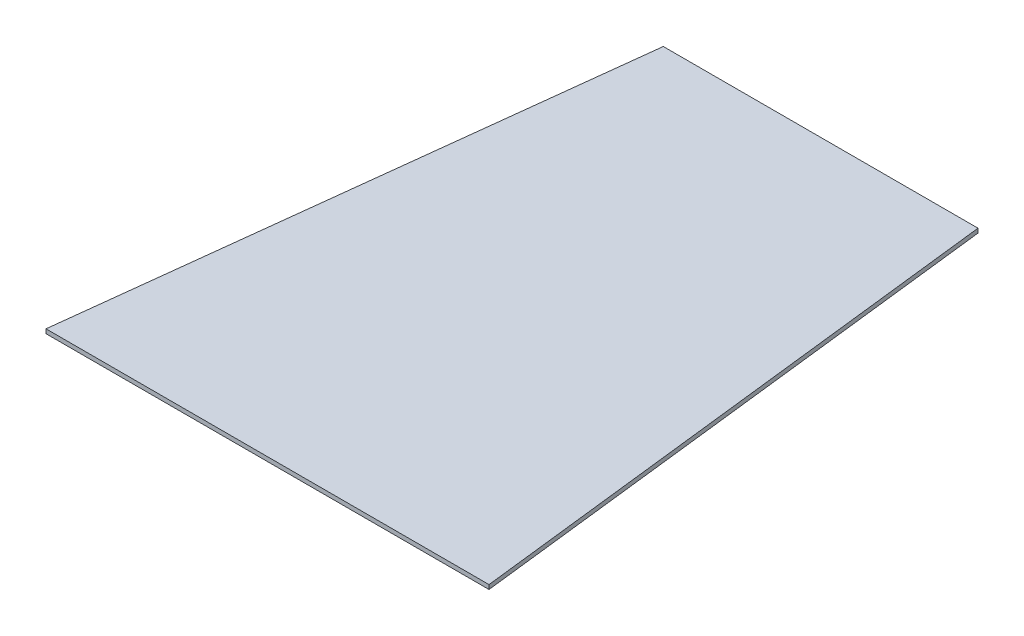
from build123d import *

# Parameters (mm, degrees)
SKETCH1_W           = 500
SKETCH1_H           = 500
BOSS_EXTRUDE1_DEPTH = 2.9972
SKETCH3_OUTSIDE_W   = 643.422
SKETCH3_OUTSIDE_H   = 643.422
CUT_EXTRUDE1_DEPTH  = 708.113133245


with BuildPart() as part:
    # Sketch1 → Boss-Extrude1 (new body)
    with BuildSketch(Plane(origin=(0, 0, 0), x_dir=(1, 0, 0), z_dir=(0, 1, 0))):
        with Locations((250, -250)):
            Rectangle(SKETCH1_W, SKETCH1_H)
    extrude(amount=BOSS_EXTRUDE1_DEPTH)

    # Sketch3 outside → Cut-Extrude1 (cut, through all)
    with BuildSketch(Plane.XZ):
        with Locations((250, 250)):
            Rectangle(SKETCH3_OUTSIDE_W, SKETCH3_OUTSIDE_H)
        Polygon((168.791021581, 0), (123.672720315, 388.954305887), (435.192377179, 388.954305887), (390.074075913, 0), align=None, mode=Mode.SUBTRACT)
    extrude(amount=-CUT_EXTRUDE1_DEPTH, mode=Mode.SUBTRACT)


solid = part.part
